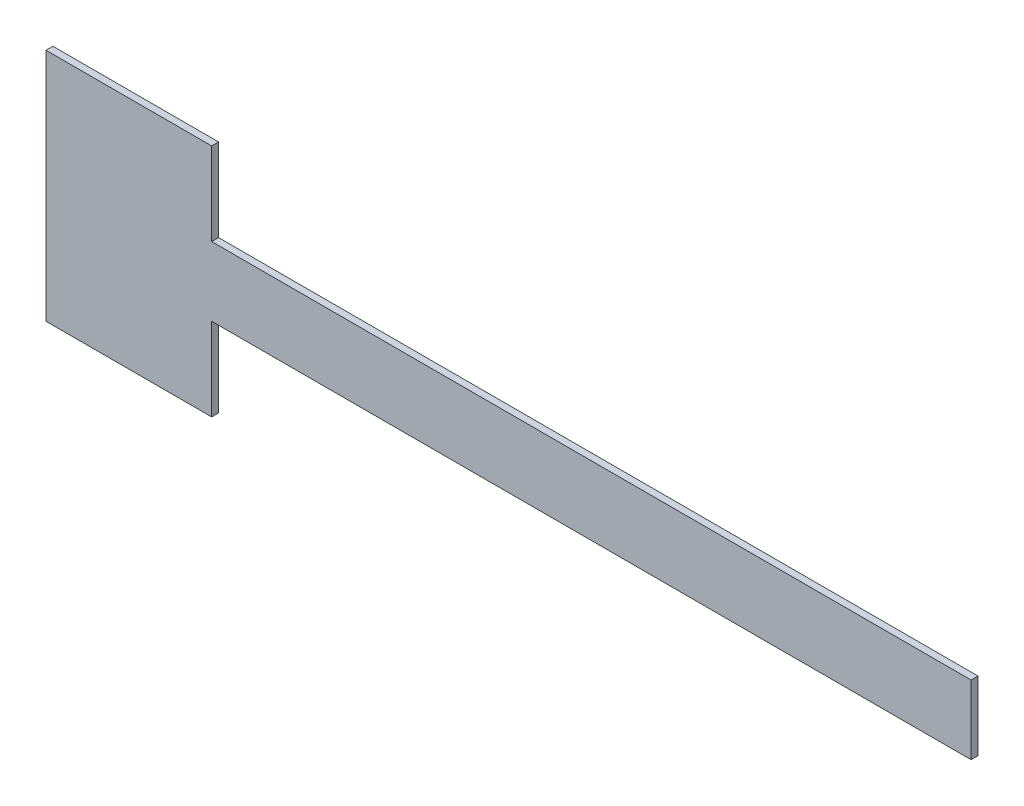
from build123d import *

# Parameters (mm, degrees)
SALIENTE_EXTRUIR1_DEPTH = 0.5


with BuildPart() as part:
    # Croquis1 → Saliente-Extruir1 (new body)
    with BuildSketch(Plane.XY):
        Polygon((0, 0), (12, 0), (12, 6), (67, 6), (67, 11), (12, 11), (12, 17), (0, 17), align=None)
    extrude(amount=SALIENTE_EXTRUIR1_DEPTH)


solid = part.part
